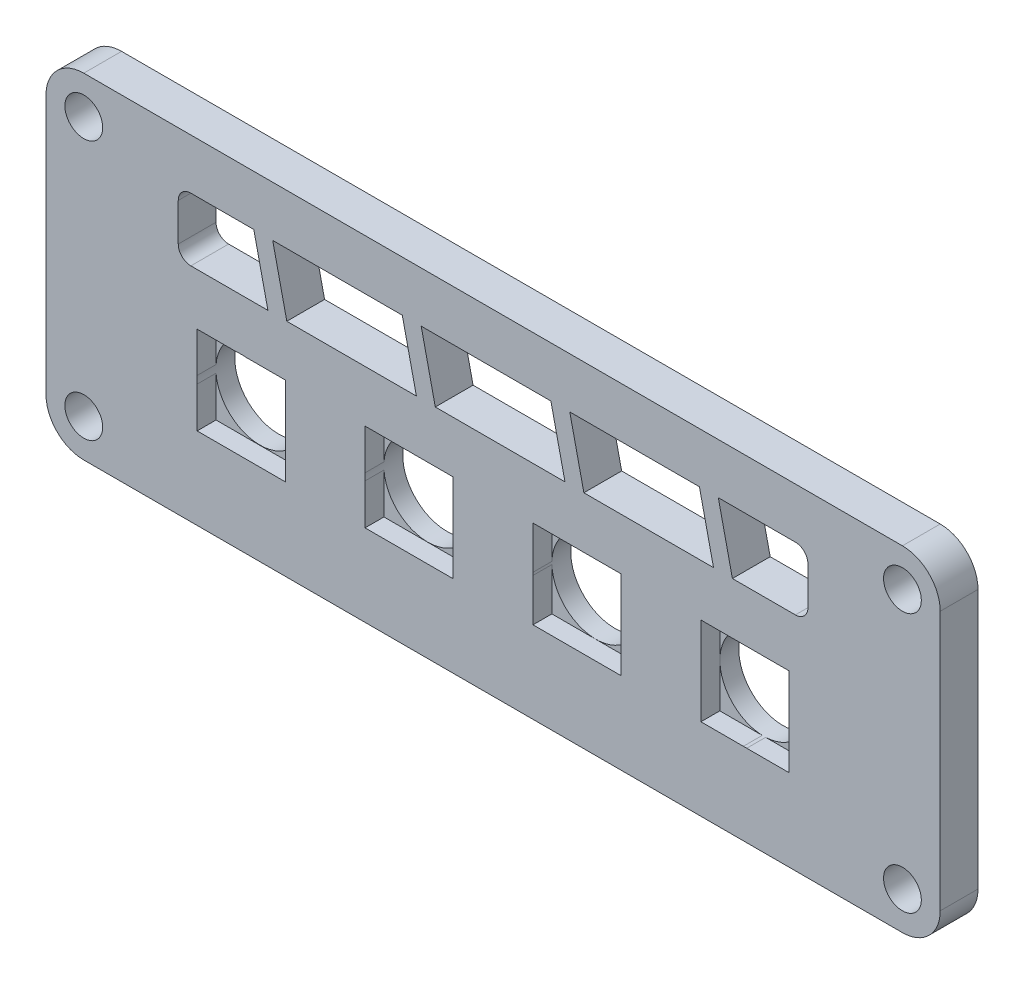
from build123d import *

# Parameters (mm, degrees)
SKETCH_1_R          = 1.5
EXTRUDE_1_DEPTH     = 3
SKETCH_2_W          = 7
SKETCH_2_H          = 7
CUT_EXTRUDE_1_DEPTH = 1.5
SKETCH_3_R          = 3.5
CUT_EXTRUDE_2_DEPTH = 3
CUT_EXTRUDE_3_DEPTH = 3


with BuildPart() as part:
    # 草图1 → 凸台-拉伸1 (new body)
    with BuildSketch(Plane.XY):
        with BuildLine():
            Line((3, 0), (68, 0))
            ThreePointArc((68, 0), (70.121320344, -0.878679656), (71, -3))
            Line((71, -3), (71, -23.6))
            ThreePointArc((71, -23.6), (70.121320344, -25.721320344), (68, -26.6))
            Line((68, -26.6), (3, -26.6))
            ThreePointArc((3, -26.6), (0.878679656, -25.721320344), (0, -23.6))
            Line((0, -23.6), (0, -3))
            ThreePointArc((0, -3), (0.878679656, -0.878679656), (3, 0))
        make_face()
        with Locations((3, -3)):
            Circle(SKETCH_1_R, mode=Mode.SUBTRACT)
        with Locations((68, -3)):
            Circle(SKETCH_1_R, mode=Mode.SUBTRACT)
        with Locations((68, -23.6)):
            Circle(SKETCH_1_R, mode=Mode.SUBTRACT)
        with Locations((3, -23.6)):
            Circle(SKETCH_1_R, mode=Mode.SUBTRACT)
    extrude(amount=EXTRUDE_1_DEPTH)

    # 草图2 → 切除-拉伸1 (cut)
    with BuildSketch(Plane.XY.offset(3)):
        with Locations((15.5, -16.6)):
            Rectangle(SKETCH_2_W, SKETCH_2_H)
        with Locations((28.833, -16.6)):
            Rectangle(SKETCH_2_W, SKETCH_2_H)
        with Locations((42.166, -16.6)):
            Rectangle(SKETCH_2_W, SKETCH_2_H)
        with Locations((55.5, -16.6)):
            Rectangle(SKETCH_2_W, SKETCH_2_H)
    extrude(amount=-CUT_EXTRUDE_1_DEPTH, mode=Mode.SUBTRACT)

    # 草图3 → 切除-拉伸2 (cut)
    with BuildSketch(Plane.XY.offset(3)):
        with Locations((15.487336513, -16.581748308)):
            Circle(SKETCH_3_R)
        with Locations((28.821952613, -16.591607422)):
            Circle(SKETCH_3_R)
        with Locations((42.164313749, -16.595901173)):
            Circle(SKETCH_3_R)
        with Locations((55.50458657, -16.602564336)):
            Circle(SKETCH_3_R)
    extrude(amount=-CUT_EXTRUDE_2_DEPTH, mode=Mode.SUBTRACT)

    # 草图4 → 切除-拉伸3 (cut)
    with BuildSketch(Plane(origin=(0, 0, 0), x_dir=(-1, 0, 0), z_dir=(0, 0, -1))):
        Polygon((-41.586971982, -4), (-51.880305316, -4), (-53, -9), (-42.706666667, -9), align=None)
        with BuildLine():
            Line((-53.380305316, -4), (-59.5, -4))
            ThreePointArc((-59.5, -4), (-60.207106781, -4.292893219), (-60.5, -5))
            Line((-60.5, -5), (-60.5, -8))
            ThreePointArc((-60.5, -8), (-60.207106781, -8.707106781), (-59.5, -9))
            Line((-59.5, -9), (-54.5, -9))
            Line((-54.5, -9), (-53.380305316, -4))
        make_face()
        Polygon((-29.79, -4), (-40.086971982, -4), (-41.206666667, -9), (-30.909694684, -9), align=None)
        Polygon((-18, -4), (-28.29, -4), (-29.409694684, -9), (-19.119694684, -9), align=None)
        with BuildLine():
            Line((-11.5, -4), (-16.5, -4))
            Line((-16.5, -4), (-17.619694684, -9))
            Line((-17.619694684, -9), (-11.5, -9))
            ThreePointArc((-11.5, -9), (-10.792893219, -8.707106781), (-10.5, -8))
            Line((-10.5, -8), (-10.5, -5))
            ThreePointArc((-10.5, -5), (-10.792893219, -4.292893219), (-11.5, -4))
        make_face()
    extrude(amount=-CUT_EXTRUDE_3_DEPTH, mode=Mode.SUBTRACT)


solid = part.part
